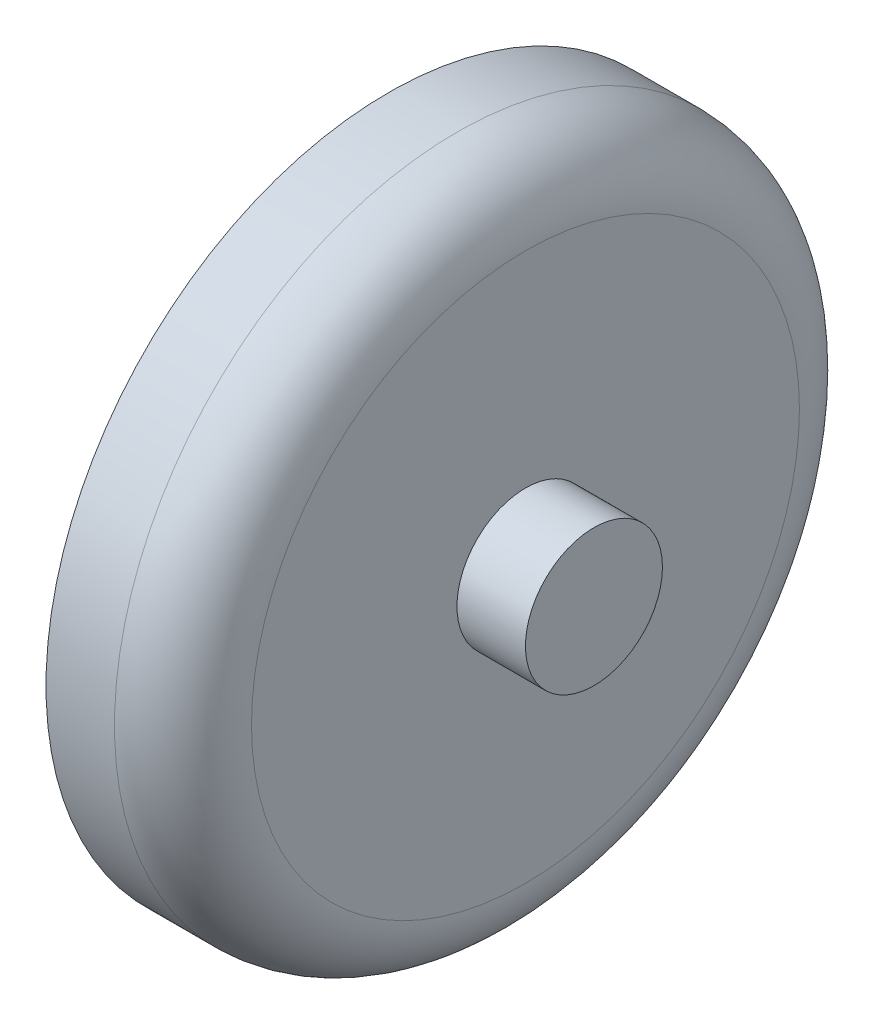
from build123d import *

# Parameters (mm, degrees)
SKETCH1_R           = 25
BOSS_EXTRUDE1_DEPTH = 10
FILLET1_R           = 5
SKETCH2_R           = 5
BOSS_EXTRUDE2_DEPTH = 5


with BuildPart() as part:
    # Sketch1 → Boss-Extrude1 (new body)
    with BuildSketch(Plane(origin=(0, 0, 0), x_dir=(0, 0, -1), z_dir=(1, 0, 0))):
        Circle(SKETCH1_R)
    extrude(amount=BOSS_EXTRUDE1_DEPTH)

    # Fillet1
    fillet1_edges = [part.edges().sort_by_distance(p)[0] for p in [
        (10, 0, 25),
    ]]
    fillet(fillet1_edges, radius=FILLET1_R)

    # Sketch2 → Boss-Extrude2 (add)
    with BuildSketch(Plane(origin=(10, 0, 0), x_dir=(0, 0, -1), z_dir=(1, 0, 0))):
        Circle(SKETCH2_R)
    extrude(amount=BOSS_EXTRUDE2_DEPTH)


solid = part.part
